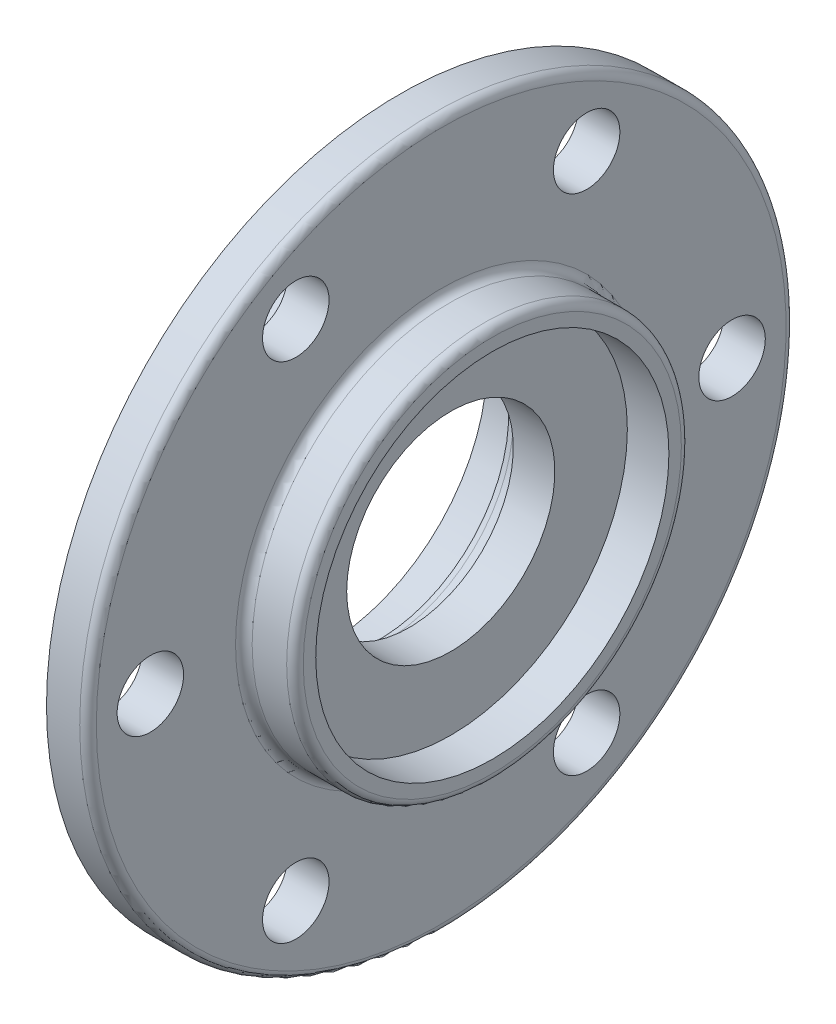
from build123d import *

# Parameters (mm, degrees)
CUT_EXTRUDE1_DEPTH      = 124.426091245
CUT_EXTRUDE1_DEPTH_BACK = 124.426091245
SKETCH2_R               = 8


with BuildPart() as part:
    # Sketch1 → Revolve1 (revolve)
    with BuildSketch(Plane.XY, mode=Mode.PRIVATE) as revolve1_sk:
        with BuildLine():
            Line((0, 45), (18, 45))
            Line((18, 45), (18, 85))
            Line((18, 85), (26, 85))
            ThreePointArc((26, 85), (27.414213562, 84.414213562), (28, 83))
            Line((28, 83), (28, 49.5))
            ThreePointArc((28, 49.5), (28.585786438, 48.085786438), (30, 47.5))
            Line((30, 47.5), (38.3, 47.5))
            ThreePointArc((38.3, 47.5), (39.714213562, 46.914213562), (40.3, 45.5))
            Line((40.3, 45.5), (40.3, 42.5))
            Line((40.3, 42.5), (30.3, 42.5))
            Line((30.3, 42.5), (30.3, 25.05))
            Line((30.3, 25.05), (20.3, 25.05))
            Line((20.3, 25.05), (20.3, 31))
            Line((20.3, 31), (14.35, 31))
            Line((14.35, 31), (13, 31.238041424))
            Line((13, 31.238041424), (13, 37))
            ThreePointArc((13, 37), (12.414213562, 38.414213562), (11, 39))
            Line((11, 39), (0, 39))
            Line((0, 39), (0, 45))
        make_face()
    revolve(revolve1_sk.sketch.rotate(Axis((0, 0, 0), (1, 0, 0)), 90), axis=Axis((0, 0, 0), (1, 0, 0)))

    # Sketch2 → Cut-Extrude1 (cut, two sides: drawn at the far end of the back side and taken through both)
    with BuildSketch(Plane(origin=(28, 0, 0), x_dir=(0, 0, -1), z_dir=(1, 0, 0)).offset(-CUT_EXTRUDE1_DEPTH_BACK)):
        with Locations((70, 0)):
            Circle(SKETCH2_R)
        with Locations((35, -60.621778265)):
            Circle(SKETCH2_R)
        with Locations((-35, -60.621778265)):
            Circle(SKETCH2_R)
        with Locations((-70, 0)):
            Circle(SKETCH2_R)
        with Locations((-35, 60.621778265)):
            Circle(SKETCH2_R)
        with Locations((35, 60.621778265)):
            Circle(SKETCH2_R)
    extrude(amount=CUT_EXTRUDE1_DEPTH + CUT_EXTRUDE1_DEPTH_BACK, mode=Mode.SUBTRACT)


solid = part.part
